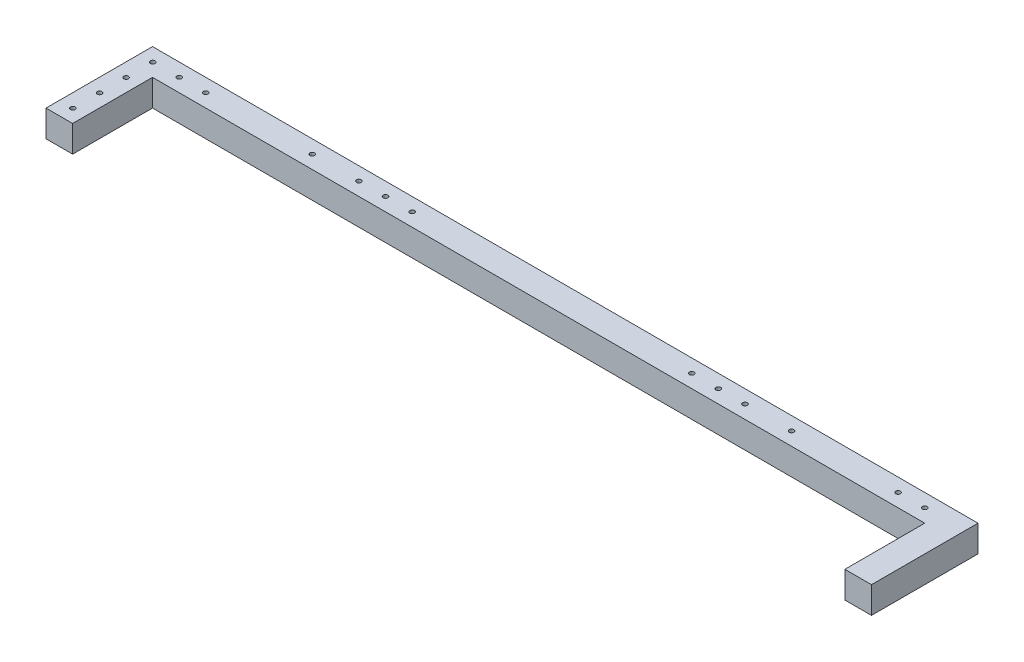
from build123d import *

# Parameters (mm, degrees)
SKETCH_1_W          = 580
SKETCH_1_H          = 20
EXTRUDE_1_DEPTH     = 20
CUT_EXTRUDE_1_REACH = 320.434
SKETCH_2_R          = 1.75
CUT_EXTRUDE_2_REACH = 320.434
SKETCH_4_R          = 1.75
CUT_EXTRUDE_3_REACH = 320.434
SKETCH_3_R          = 1.75


with BuildPart() as part:
    # 草图1 → 凸台-拉伸1 (new body)
    with BuildSketch(Plane(origin=(0, 0, 0), x_dir=(1, 0, 0), z_dir=(0, 1, 0))):
        Rectangle(SKETCH_1_W, SKETCH_1_H)
        Polygon((-290, -70), (-290, -10), (-290, 10), (-310, 10), (-310, -70), align=None)
        Polygon((290, 10), (290, -10), (290, -70), (310, -70), (310, 10), align=None)
    extrude(amount=EXTRUDE_1_DEPTH)

    # 草图2 → 切除-拉伸1 (cut, up to next)
    with BuildSketch(Plane(origin=(0, 20, 0), x_dir=(1, 0, 0), z_dir=(0, 1, 0)), mode=Mode.PRIVATE) as cut_extrude_1_sk1:
        with Locations(Location((-299.785666285, -40, 0), (0, 0, 270))):
            Circle(SKETCH_2_R)
    cut_extrude_1_tool1 = extrude(cut_extrude_1_sk1.sketch, amount=-CUT_EXTRUDE_1_REACH, mode=Mode.PRIVATE) & part.part
    # 草图2 → 切除-拉伸1 (cut, up to next)
    with BuildSketch(Plane(origin=(0, 20, 0), x_dir=(1, 0, 0), z_dir=(0, 1, 0)), mode=Mode.PRIVATE) as cut_extrude_1_sk2:
        with Locations(Location((-299.785666285, -60, 0), (0, 0, 270))):
            Circle(SKETCH_2_R)
    cut_extrude_1_tool2 = extrude(cut_extrude_1_sk2.sketch, amount=-CUT_EXTRUDE_1_REACH, mode=Mode.PRIVATE) & part.part
    # 草图2 → 切除-拉伸1 (cut, up to next)
    with BuildSketch(Plane(origin=(0, 20, 0), x_dir=(1, 0, 0), z_dir=(0, 1, 0)), mode=Mode.PRIVATE) as cut_extrude_1_sk3:
        with Locations(Location((-299.785666285, -20, 0), (0, 0, 270))):
            Circle(SKETCH_2_R)
    cut_extrude_1_tool3 = extrude(cut_extrude_1_sk3.sketch, amount=-CUT_EXTRUDE_1_REACH, mode=Mode.PRIVATE) & part.part
    # 草图2 → 切除-拉伸1 (cut, up to next)
    with BuildSketch(Plane(origin=(0, 20, 0), x_dir=(1, 0, 0), z_dir=(0, 1, 0)), mode=Mode.PRIVATE) as cut_extrude_1_sk4:
        with Locations(Location((-299.785666285, 0, 0), (0, 0, 270))):
            Circle(SKETCH_2_R)
    cut_extrude_1_tool4 = extrude(cut_extrude_1_sk4.sketch, amount=-CUT_EXTRUDE_1_REACH, mode=Mode.PRIVATE) & part.part
    add(cut_extrude_1_tool1.solids().sort_by_distance((-299.785666, 20, 40))[0], mode=Mode.SUBTRACT)
    add(cut_extrude_1_tool2.solids().sort_by_distance((-299.785666, 20, 60))[0], mode=Mode.SUBTRACT)
    add(cut_extrude_1_tool3.solids().sort_by_distance((-299.785666, 20, 20))[0], mode=Mode.SUBTRACT)
    add(cut_extrude_1_tool4.solids().sort_by_distance((-299.785666, 20, 0))[0], mode=Mode.SUBTRACT)

    # 草图4 → 切除-拉伸2 (cut, up to next)
    with BuildSketch(Plane(origin=(0, 20, 0), x_dir=(1, 0, 0), z_dir=(0, 1, 0)), mode=Mode.PRIVATE) as cut_extrude_2_sk1:
        with Locations(Location((-125, 0, 0), (0, 0, 270))):
            Circle(SKETCH_4_R)
    cut_extrude_2_tool1 = extrude(cut_extrude_2_sk1.sketch, amount=-CUT_EXTRUDE_2_REACH, mode=Mode.PRIVATE) & part.part
    # 草图4 → 切除-拉伸2 (cut, up to next)
    with BuildSketch(Plane(origin=(0, 20, 0), x_dir=(1, 0, 0), z_dir=(0, 1, 0)), mode=Mode.PRIVATE) as cut_extrude_2_sk2:
        with Locations(Location((-105, 0, 0), (0, 0, 270))):
            Circle(SKETCH_4_R)
    cut_extrude_2_tool2 = extrude(cut_extrude_2_sk2.sketch, amount=-CUT_EXTRUDE_2_REACH, mode=Mode.PRIVATE) & part.part
    # 草图4 → 切除-拉伸2 (cut, up to next)
    with BuildSketch(Plane(origin=(0, 20, 0), x_dir=(1, 0, 0), z_dir=(0, 1, 0)), mode=Mode.PRIVATE) as cut_extrude_2_sk3:
        with Locations(Location((-145, 0, 0), (0, 0, 270))):
            Circle(SKETCH_4_R)
    cut_extrude_2_tool3 = extrude(cut_extrude_2_sk3.sketch, amount=-CUT_EXTRUDE_2_REACH, mode=Mode.PRIVATE) & part.part
    # 草图4 → 切除-拉伸2 (cut, up to next)
    with BuildSketch(Plane(origin=(0, 20, 0), x_dir=(1, 0, 0), z_dir=(0, 1, 0)), mode=Mode.PRIVATE) as cut_extrude_2_sk4:
        with Locations(Location((105, 0, 0), (0, 0, 270))):
            Circle(SKETCH_4_R)
    cut_extrude_2_tool4 = extrude(cut_extrude_2_sk4.sketch, amount=-CUT_EXTRUDE_2_REACH, mode=Mode.PRIVATE) & part.part
    # 草图4 → 切除-拉伸2 (cut, up to next)
    with BuildSketch(Plane(origin=(0, 20, 0), x_dir=(1, 0, 0), z_dir=(0, 1, 0)), mode=Mode.PRIVATE) as cut_extrude_2_sk5:
        with Locations(Location((125, 0, 0), (0, 0, 270))):
            Circle(SKETCH_4_R)
    cut_extrude_2_tool5 = extrude(cut_extrude_2_sk5.sketch, amount=-CUT_EXTRUDE_2_REACH, mode=Mode.PRIVATE) & part.part
    # 草图4 → 切除-拉伸2 (cut, up to next)
    with BuildSketch(Plane(origin=(0, 20, 0), x_dir=(1, 0, 0), z_dir=(0, 1, 0)), mode=Mode.PRIVATE) as cut_extrude_2_sk6:
        with Locations(Location((145, 0, 0), (0, 0, 270))):
            Circle(SKETCH_4_R)
    cut_extrude_2_tool6 = extrude(cut_extrude_2_sk6.sketch, amount=-CUT_EXTRUDE_2_REACH, mode=Mode.PRIVATE) & part.part
    add(cut_extrude_2_tool1.solids().sort_by_distance((-125, 20, 0))[0], mode=Mode.SUBTRACT)
    add(cut_extrude_2_tool2.solids().sort_by_distance((-105, 20, 0))[0], mode=Mode.SUBTRACT)
    add(cut_extrude_2_tool3.solids().sort_by_distance((-145, 20, 0))[0], mode=Mode.SUBTRACT)
    add(cut_extrude_2_tool4.solids().sort_by_distance((105, 20, 0))[0], mode=Mode.SUBTRACT)
    add(cut_extrude_2_tool5.solids().sort_by_distance((125, 20, 0))[0], mode=Mode.SUBTRACT)
    add(cut_extrude_2_tool6.solids().sort_by_distance((145, 20, 0))[0], mode=Mode.SUBTRACT)

    # 草图3 → 切除-拉伸3 (cut, up to next)
    with BuildSketch(Plane.XZ, mode=Mode.PRIVATE) as cut_extrude_3_sk1:
        with Locations(Location((180, 0, 0), (0, 0, 270))):
            Circle(SKETCH_3_R)
    cut_extrude_3_tool1 = extrude(cut_extrude_3_sk1.sketch, amount=-CUT_EXTRUDE_3_REACH, mode=Mode.PRIVATE) & part.part
    # 草图3 → 切除-拉伸3 (cut, up to next)
    with BuildSketch(Plane.XZ, mode=Mode.PRIVATE) as cut_extrude_3_sk2:
        with Locations(Location((280, 0, 0), (0, 0, 270))):
            Circle(SKETCH_3_R)
    cut_extrude_3_tool2 = extrude(cut_extrude_3_sk2.sketch, amount=-CUT_EXTRUDE_3_REACH, mode=Mode.PRIVATE) & part.part
    # 草图3 → 切除-拉伸3 (cut, up to next)
    with BuildSketch(Plane.XZ, mode=Mode.PRIVATE) as cut_extrude_3_sk3:
        with Locations(Location((260, 0, 0), (0, 0, 270))):
            Circle(SKETCH_3_R)
    cut_extrude_3_tool3 = extrude(cut_extrude_3_sk3.sketch, amount=-CUT_EXTRUDE_3_REACH, mode=Mode.PRIVATE) & part.part
    # 草图3 → 切除-拉伸3 (cut, up to next)
    with BuildSketch(Plane.XZ, mode=Mode.PRIVATE) as cut_extrude_3_sk4:
        with Locations(Location((-280, 0, 0), (0, 0, 270))):
            Circle(SKETCH_3_R)
    cut_extrude_3_tool4 = extrude(cut_extrude_3_sk4.sketch, amount=-CUT_EXTRUDE_3_REACH, mode=Mode.PRIVATE) & part.part
    # 草图3 → 切除-拉伸3 (cut, up to next)
    with BuildSketch(Plane.XZ, mode=Mode.PRIVATE) as cut_extrude_3_sk5:
        with Locations(Location((-260, 0, 0), (0, 0, 270))):
            Circle(SKETCH_3_R)
    cut_extrude_3_tool5 = extrude(cut_extrude_3_sk5.sketch, amount=-CUT_EXTRUDE_3_REACH, mode=Mode.PRIVATE) & part.part
    # 草图3 → 切除-拉伸3 (cut, up to next)
    with BuildSketch(Plane.XZ, mode=Mode.PRIVATE) as cut_extrude_3_sk6:
        with Locations(Location((-180, 0, 0), (0, 0, 270))):
            Circle(SKETCH_3_R)
    cut_extrude_3_tool6 = extrude(cut_extrude_3_sk6.sketch, amount=-CUT_EXTRUDE_3_REACH, mode=Mode.PRIVATE) & part.part
    add(cut_extrude_3_tool1.solids().sort_by_distance((180, 0, 0))[0], mode=Mode.SUBTRACT)
    add(cut_extrude_3_tool2.solids().sort_by_distance((280, 0, 0))[0], mode=Mode.SUBTRACT)
    add(cut_extrude_3_tool3.solids().sort_by_distance((260, 0, 0))[0], mode=Mode.SUBTRACT)
    add(cut_extrude_3_tool4.solids().sort_by_distance((-280, 0, 0))[0], mode=Mode.SUBTRACT)
    add(cut_extrude_3_tool5.solids().sort_by_distance((-260, 0, 0))[0], mode=Mode.SUBTRACT)
    add(cut_extrude_3_tool6.solids().sort_by_distance((-180, 0, 0))[0], mode=Mode.SUBTRACT)


solid = part.part
